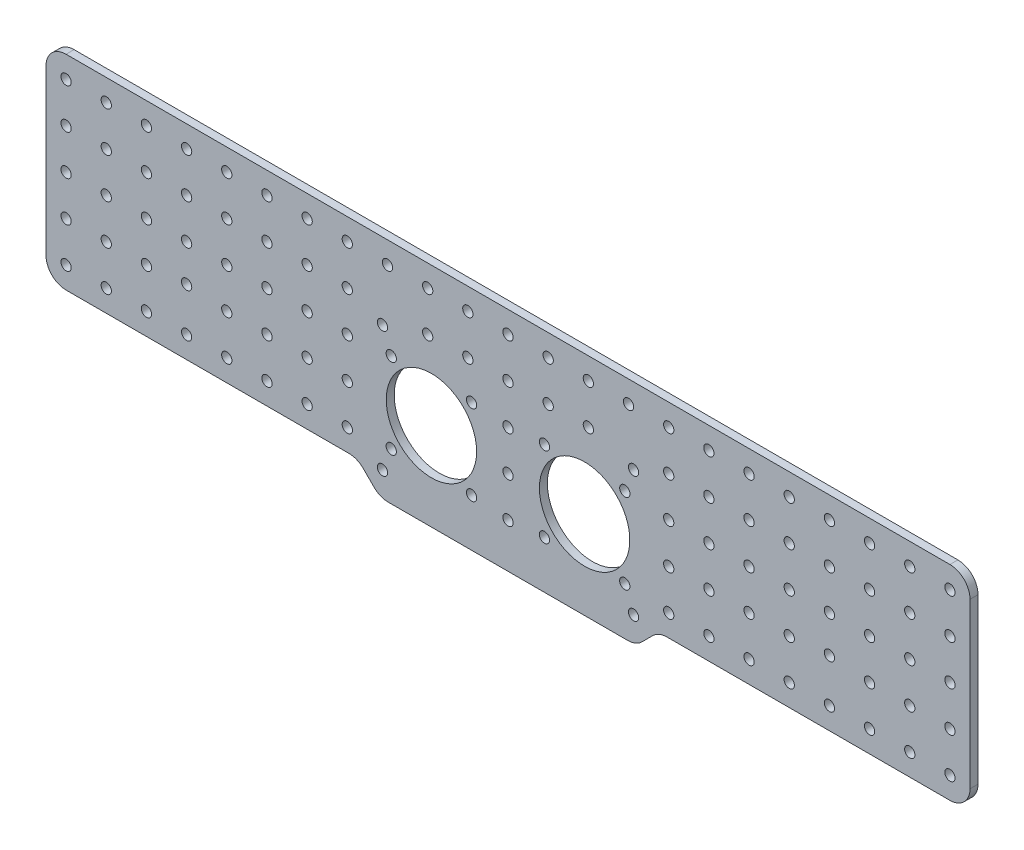
from build123d import *

# Parameters (mm, degrees)
SKETCH1_W           = 368
SKETCH1_H           = 90.35
SKETCH1_R           = 18
SKETCH1_R_2         = 2.05
BOSS_EXTRUDE1_DEPTH = 3.175
SKETCH3_R           = 2.05
CUT_EXTRUDE1_DEPTH  = 3.18
CUT_EXTRUDE2_DEPTH  = 10
FILLET1_R           = 8


with BuildPart() as part:
    # Sketch1 → Boss-Extrude1 (new body)
    with BuildSketch(Plane.XY):
        Rectangle(SKETCH1_W, SKETCH1_H)
        with Locations((-30.504419684, -10.175)):
            Circle(SKETCH1_R, mode=Mode.SUBTRACT)
        with Locations((-128, -10.175)):
            Circle(SKETCH1_R_2, mode=Mode.SUBTRACT)
        with Locations(Location((128, -10.175, 0), (0, 0, 180))):
            Circle(SKETCH1_R_2, mode=Mode.SUBTRACT)
        with Locations(Location((30.504419684, -10.175, 0), (0, 0, 180))):
            Circle(SKETCH1_R, mode=Mode.SUBTRACT)
        with Locations((-50, 14.825)):
            Circle(SKETCH1_R_2, mode=Mode.SUBTRACT)
        with Locations((50, 14.825)):
            Circle(SKETCH1_R_2, mode=Mode.SUBTRACT)
        with Locations((50, -35.175)):
            Circle(SKETCH1_R_2, mode=Mode.SUBTRACT)
        with Locations((-50, -35.175)):
            Circle(SKETCH1_R_2, mode=Mode.SUBTRACT)
        with Locations((-46.504419684, 5.825)):
            Circle(SKETCH1_R_2, mode=Mode.SUBTRACT)
        with Locations((-14.504419684, 5.825)):
            Circle(SKETCH1_R_2, mode=Mode.SUBTRACT)
        with Locations((-14.504419684, -26.175)):
            Circle(SKETCH1_R_2, mode=Mode.SUBTRACT)
        with Locations((-46.504419684, -26.175)):
            Circle(SKETCH1_R_2, mode=Mode.SUBTRACT)
        with Locations(Location((46.504419684, 5.825, 0), (0, 0, 180))):
            Circle(SKETCH1_R_2, mode=Mode.SUBTRACT)
        with Locations(Location((14.504419684, 5.825, 0), (0, 0, 180))):
            Circle(SKETCH1_R_2, mode=Mode.SUBTRACT)
        with Locations(Location((46.504419684, -26.175, 0), (0, 0, 180))):
            Circle(SKETCH1_R_2, mode=Mode.SUBTRACT)
        with Locations(Location((14.504419684, -26.175, 0), (0, 0, 180))):
            Circle(SKETCH1_R_2, mode=Mode.SUBTRACT)
    extrude(amount=BOSS_EXTRUDE1_DEPTH)

    # Sketch3 → Cut-Extrude1 (cut)
    with BuildSketch(Plane.XY.offset(3.175)):
        with Locations((-176, 36.5)):
            Circle(SKETCH3_R)
        with Locations((-160, 36.5)):
            Circle(SKETCH3_R)
        with Locations((-144, 36.5)):
            Circle(SKETCH3_R)
        with Locations((-128, 36.5)):
            Circle(SKETCH3_R)
        with Locations((-112, 36.5)):
            Circle(SKETCH3_R)
        with Locations((-96, 36.5)):
            Circle(SKETCH3_R)
        with Locations((-80, 36.5)):
            Circle(SKETCH3_R)
        with Locations((-64, 36.5)):
            Circle(SKETCH3_R)
        with Locations((-48, 36.5)):
            Circle(SKETCH3_R)
        with Locations((-32, 36.5)):
            Circle(SKETCH3_R)
        with Locations((-16, 36.5)):
            Circle(SKETCH3_R)
        with Locations((0, 36.5)):
            Circle(SKETCH3_R)
        with Locations((16, 36.5)):
            Circle(SKETCH3_R)
        with Locations((32, 36.5)):
            Circle(SKETCH3_R)
        with Locations((48, 36.5)):
            Circle(SKETCH3_R)
        with Locations((64, 36.5)):
            Circle(SKETCH3_R)
        with Locations((80, 36.5)):
            Circle(SKETCH3_R)
        with Locations((96, 36.5)):
            Circle(SKETCH3_R)
        with Locations((112, 36.5)):
            Circle(SKETCH3_R)
        with Locations((128, 36.5)):
            Circle(SKETCH3_R)
        with Locations((144, 36.5)):
            Circle(SKETCH3_R)
        with Locations((160, 36.5)):
            Circle(SKETCH3_R)
        with Locations((176, 36.5)):
            Circle(SKETCH3_R)
        with Locations((-160, 20.5)):
            Circle(SKETCH3_R)
        with Locations((-144, 20.5)):
            Circle(SKETCH3_R)
        with Locations((-128, 20.5)):
            Circle(SKETCH3_R)
        with Locations((-112, 20.5)):
            Circle(SKETCH3_R)
        with Locations((-96, 20.5)):
            Circle(SKETCH3_R)
        with Locations((-80, 20.5)):
            Circle(SKETCH3_R)
        with Locations((-64, 20.5)):
            Circle(SKETCH3_R)
        with Locations((-32, 20.5)):
            Circle(SKETCH3_R)
        with Locations((-16, 20.5)):
            Circle(SKETCH3_R)
        with Locations((0, 20.5)):
            Circle(SKETCH3_R)
        with Locations((16, 20.5)):
            Circle(SKETCH3_R)
        with Locations((32, 20.5)):
            Circle(SKETCH3_R)
        with Locations((64, 20.5)):
            Circle(SKETCH3_R)
        with Locations((80, 20.5)):
            Circle(SKETCH3_R)
        with Locations((96, 20.5)):
            Circle(SKETCH3_R)
        with Locations((112, 20.5)):
            Circle(SKETCH3_R)
        with Locations((128, 20.5)):
            Circle(SKETCH3_R)
        with Locations((144, 20.5)):
            Circle(SKETCH3_R)
        with Locations((160, 20.5)):
            Circle(SKETCH3_R)
        with Locations((176, 20.5)):
            Circle(SKETCH3_R)
        with Locations((-160, 4.5)):
            Circle(SKETCH3_R)
        with Locations((-144, 4.5)):
            Circle(SKETCH3_R)
        with Locations((-128, 4.5)):
            Circle(SKETCH3_R)
        with Locations((-112, 4.5)):
            Circle(SKETCH3_R)
        with Locations((-96, 4.5)):
            Circle(SKETCH3_R)
        with Locations((-80, 4.5)):
            Circle(SKETCH3_R)
        with Locations((-64, 4.5)):
            Circle(SKETCH3_R)
        with Locations((0, 4.5)):
            Circle(SKETCH3_R)
        with Locations((64, 4.5)):
            Circle(SKETCH3_R)
        with Locations((80, 4.5)):
            Circle(SKETCH3_R)
        with Locations((96, 4.5)):
            Circle(SKETCH3_R)
        with Locations((112, 4.5)):
            Circle(SKETCH3_R)
        with Locations((128, 4.5)):
            Circle(SKETCH3_R)
        with Locations((144, 4.5)):
            Circle(SKETCH3_R)
        with Locations((160, 4.5)):
            Circle(SKETCH3_R)
        with Locations((176, 4.5)):
            Circle(SKETCH3_R)
        with Locations((-160, -11.5)):
            Circle(SKETCH3_R)
        with Locations((-144, -11.5)):
            Circle(SKETCH3_R)
        with Locations((-112, -11.5)):
            Circle(SKETCH3_R)
        with Locations((-96, -11.5)):
            Circle(SKETCH3_R)
        with Locations((-80, -11.5)):
            Circle(SKETCH3_R)
        with Locations((-64, -11.5)):
            Circle(SKETCH3_R)
        with Locations((0, -11.5)):
            Circle(SKETCH3_R)
        with Locations((64, -11.5)):
            Circle(SKETCH3_R)
        with Locations((80, -11.5)):
            Circle(SKETCH3_R)
        with Locations((96, -11.5)):
            Circle(SKETCH3_R)
        with Locations((112, -11.5)):
            Circle(SKETCH3_R)
        with Locations((144, -11.5)):
            Circle(SKETCH3_R)
        with Locations((160, -11.5)):
            Circle(SKETCH3_R)
        with Locations((176, -11.5)):
            Circle(SKETCH3_R)
        with Locations((-160, -27.5)):
            Circle(SKETCH3_R)
        with Locations((-144, -27.5)):
            Circle(SKETCH3_R)
        with Locations((-128, -27.5)):
            Circle(SKETCH3_R)
        with Locations((-112, -27.5)):
            Circle(SKETCH3_R)
        with Locations((-96, -27.5)):
            Circle(SKETCH3_R)
        with Locations((-80, -27.5)):
            Circle(SKETCH3_R)
        with Locations((-64, -27.5)):
            Circle(SKETCH3_R)
        with Locations((0, -27.5)):
            Circle(SKETCH3_R)
        with Locations((64, -27.5)):
            Circle(SKETCH3_R)
        with Locations((80, -27.5)):
            Circle(SKETCH3_R)
        with Locations((96, -27.5)):
            Circle(SKETCH3_R)
        with Locations((112, -27.5)):
            Circle(SKETCH3_R)
        with Locations((128, -27.5)):
            Circle(SKETCH3_R)
        with Locations((144, -27.5)):
            Circle(SKETCH3_R)
        with Locations((160, -27.5)):
            Circle(SKETCH3_R)
        with Locations((176, -27.5)):
            Circle(SKETCH3_R)
        with Locations((-176, 20.5)):
            Circle(SKETCH3_R)
        with Locations((-176, 4.5)):
            Circle(SKETCH3_R)
        with Locations((-176, -11.5)):
            Circle(SKETCH3_R)
        with Locations((-176, -27.5)):
            Circle(SKETCH3_R)
    extrude(amount=-CUT_EXTRUDE1_DEPTH, mode=Mode.SUBTRACT)

    # Sketch4 → Cut-Extrude2 (cut)
    with BuildSketch(Plane.XY.offset(3.175)):
        Polygon((-184, -36.18), (-60, -36.18), (-51.005, -45.175), (-184, -45.175), align=None)
        Polygon((51.005, -45.175), (184, -45.175), (184, -36.18), (60, -36.18), align=None)
    extrude(amount=-CUT_EXTRUDE2_DEPTH, mode=Mode.SUBTRACT)

    # Fillet1
    fillet1_edges = [part.edges().sort_by_distance(p)[0] for p in [
        (184, -36.18, 1.5875),
        (-51.005, -45.175, 1.5875),
        (-184, -36.18, 1.5875),
        (-60, -36.18, 1.5875),
        (51.005, -45.175, 1.5875),
        (60, -36.18, 1.5875),
        (-184, 45.175, 1.5875),
        (184, 45.175, 1.5875),
    ]]
    fillet(fillet1_edges, radius=FILLET1_R)


solid = part.part
